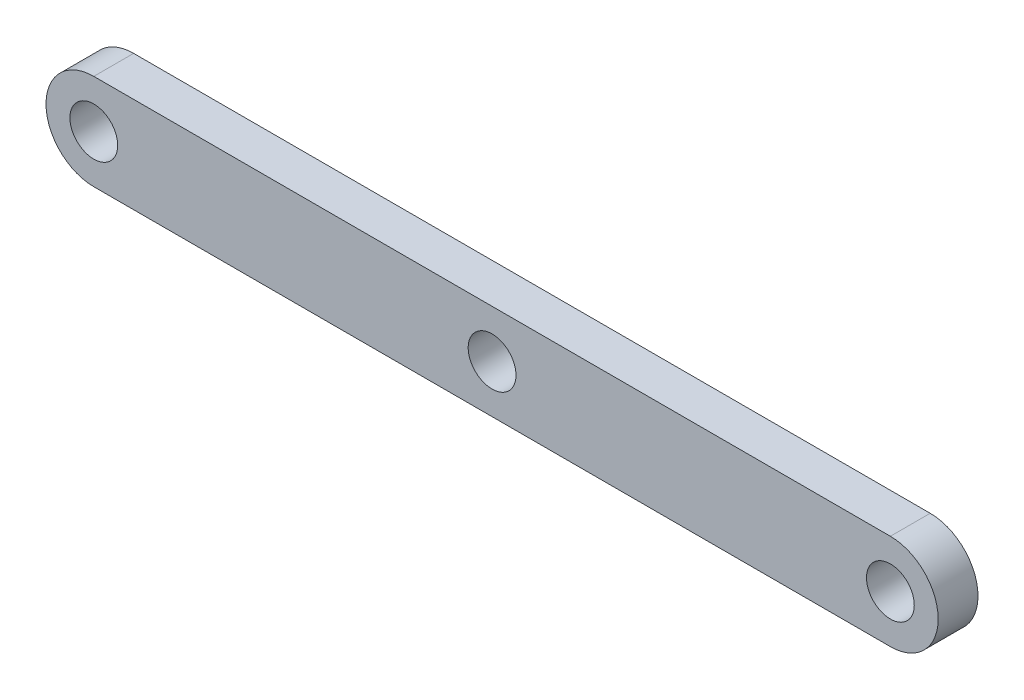
from build123d import *

# Parameters (mm, degrees)
SKETCH1_R           = 3
BOSS_EXTRUDE1_DEPTH = 2.5


with BuildPart() as part:
    # Sketch1 → Boss-Extrude1 (new, symmetric)
    with BuildSketch(Plane.XY):
        with BuildLine():
            Line((-50, 6), (50, 6))
            ThreePointArc((50, 6), (56, 0), (50, -6))
            Line((50, -6), (-50, -6))
            ThreePointArc((-50, -6), (-56, 0), (-50, 6))
        make_face()
        with Locations((-50, 0)):
            Circle(SKETCH1_R, mode=Mode.SUBTRACT)
        with Locations((50, 0)):
            Circle(SKETCH1_R, mode=Mode.SUBTRACT)
        Circle(SKETCH1_R, mode=Mode.SUBTRACT)
    extrude(amount=BOSS_EXTRUDE1_DEPTH, both=True)


solid = part.part
